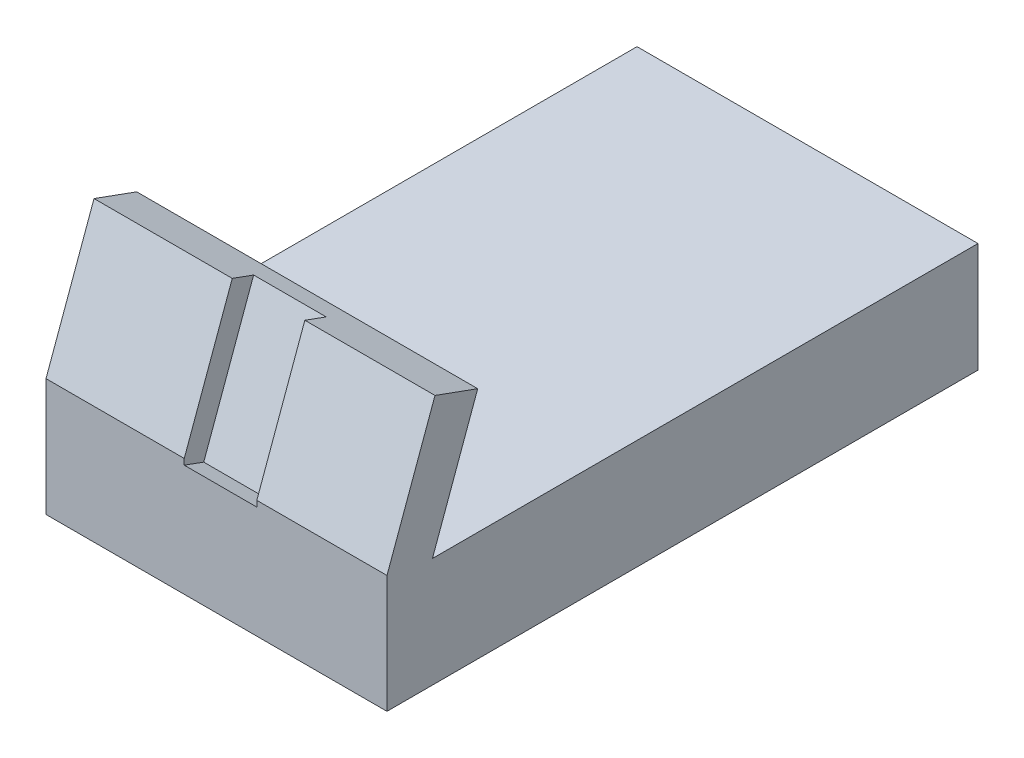
from build123d import *

# Parameters (mm, degrees)
BOSS_EXTRUDE1_DEPTH = 75
SKETCH2_W           = 15.96
SKETCH2_H           = 40
CUT_EXTRUDE1_DEPTH  = 5


with BuildPart() as part:
    # Sketch1 → Boss-Extrude1 (new body)
    with BuildSketch(Plane(origin=(0, 0, 0), x_dir=(0, 0, -1), z_dir=(1, 0, 0))):
        Polygon((65, -12.06), (-65, -12.06), (-65, 13.823269807), (-54.438417974, 42.840977937), (-45.040373426, 39.423849117), (-55, 12.06), (65, 12.06), align=None)
    extrude(amount=-BOSS_EXTRUDE1_DEPTH)

    # Sketch2 → Cut-Extrude1 (cut)
    with BuildSketch(Plane(origin=(0, 22.507612708, 61.83915768), x_dir=(1, 0, 0), z_dir=(0, 0.342020143325673, 0.9396926207859068))):
        with Locations((-36.611821511, 9.548315317)):
            Rectangle(SKETCH2_W, SKETCH2_H)
    extrude(amount=-CUT_EXTRUDE1_DEPTH, mode=Mode.SUBTRACT)


solid = part.part
